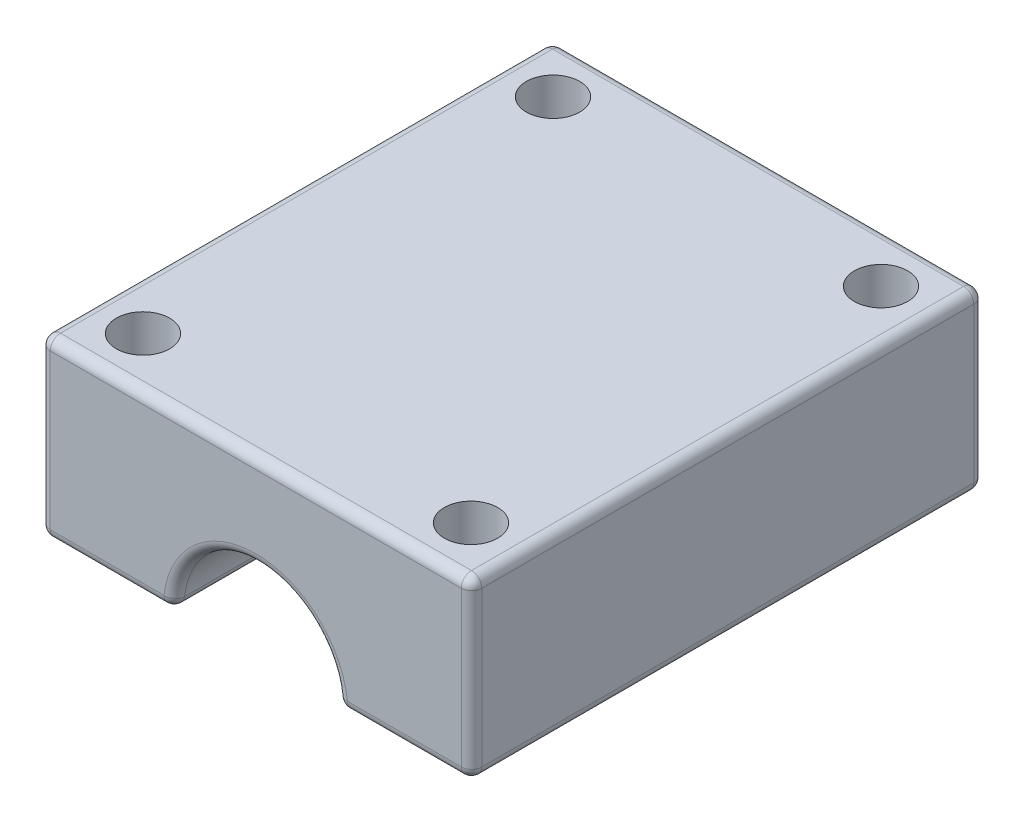
from build123d import *

# Parameters (mm, degrees)
SKETCH1_W               = 42.1
SKETCH1_H               = 50
BOSS_EXTRUDE1_DEPTH     = 17.1
SKETCH2_R               = 2.6
CUT_EXTRUDE1_DEPTH      = 37.885125728
MIRROR3_COPY_1_SKETCH_R = 2.6
MIRROR3_COPY_1_DEPTH    = 37.885125728
SKETCH3_R               = 4.5
CUT_EXTRUDE2_DEPTH      = 57.881565555
SKETCH4_R               = 8
CUT_EXTRUDE3_DEPTH      = 10
FILLET1_R               = 1


with BuildPart() as part:
    # Sketch1 → Boss-Extrude1 (new body)
    with BuildSketch(Plane(origin=(0, 0, 0), x_dir=(1, 0, 0), z_dir=(0, 1, 0))):
        Rectangle(SKETCH1_W, SKETCH1_H)
    extrude(amount=BOSS_EXTRUDE1_DEPTH)

    # Sketch2 → Cut-Extrude1 (cut, through all)
    with BuildSketch(Plane(origin=(0, 17.1, 0), x_dir=(1, 0, 0), z_dir=(0, 1, 0))):
        with Locations(Location((-16, -20, 0), (0, 0, 270))):
            Circle(SKETCH2_R)
    cut_extrude1 = extrude(amount=-CUT_EXTRUDE1_DEPTH, mode=Mode.SUBTRACT)

    # Mirror2: Cut-Extrude1 across plane
    add(cut_extrude1.mirror(Plane.XY), mode=Mode.SUBTRACT)

    # Mirror3: Cut-Extrude1 across plane
    add(cut_extrude1.mirror(Plane(origin=(0, 0, 0), x_dir=(0, 0, 1), z_dir=(1, 0, 0))), mode=Mode.SUBTRACT)

    # Mirror3 copy 1 sketch → Mirror3 copy 1 (cut, through all)
    with BuildSketch(Plane(origin=(0, 17.1, 0), x_dir=(-1, 0, 0), z_dir=(0, 1, 0))):
        with Locations(Location((-16, -20, 0), (0, 0, 270))):
            Circle(MIRROR3_COPY_1_SKETCH_R)
    extrude(amount=-MIRROR3_COPY_1_DEPTH, mode=Mode.SUBTRACT)

    # Sketch3 → Cut-Extrude2 (cut, through all)
    with BuildSketch(Plane.XY.offset(25)):
        Circle(SKETCH3_R)
    extrude(amount=-CUT_EXTRUDE2_DEPTH, mode=Mode.SUBTRACT)

    # Sketch4 → Cut-Extrude3 (cut)
    with BuildSketch(Plane.XY.offset(25)):
        Circle(SKETCH4_R)
    extrude(amount=-CUT_EXTRUDE3_DEPTH, mode=Mode.SUBTRACT)

    # Fillet1
    fillet1_edges = [part.edges().sort_by_distance(p)[0] for p in [
        (-21.05, 17.1, 0),
        (0, 17.1, 25),
        (-12.775, 0, -25),
        (4.5, 0, -5),
        (0, 4.5, -25),
        (21.05, 17.1, 0),
        (-4.5, 0, -5),
        (0, 4.5, 15),
        (14.525, 0, 25),
        (-14.525, 0, 25),
        (8, 0, 20),
        (-8, 0, 20),
        (0, 8, 15),
        (6.25, 0, 15),
        (-6.25, 0, 15),
        (0, 8, 25),
        (-21.05, 0, 0),
        (12.775, 0, -25),
        (21.05, 0, 0),
        (0, 17.1, -25),
        (21.05, 8.55, 25),
        (-21.05, 8.55, 25),
        (-21.05, 8.55, -25),
        (21.05, 8.55, -25),
    ]]
    fillet(fillet1_edges, radius=FILLET1_R)


solid = part.part
